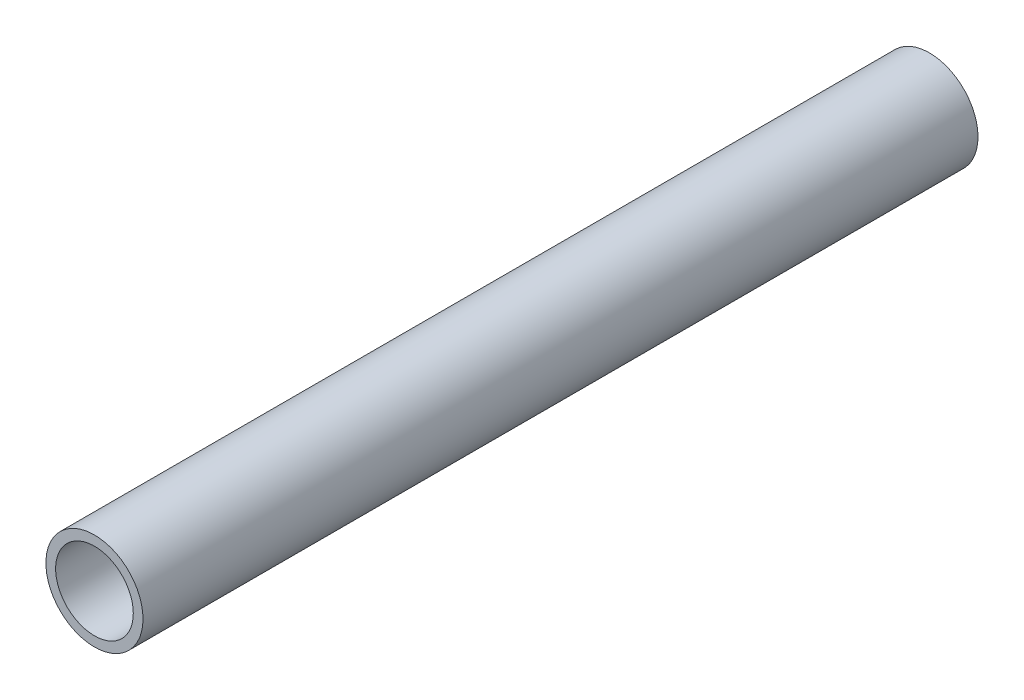
from build123d import *

# Parameters (mm, degrees)
SKETCH25_R           = 50
SKETCH25_R_2         = 40
BOSS_EXTRUDE16_DEPTH = 860


with BuildPart() as part:
    # Sketch25 → Boss-Extrude16 (new body)
    with BuildSketch(Plane.XY):
        with Locations((-894.504762148, 1142.583065453)):
            Circle(SKETCH25_R)
        with Locations((-894.504762148, 1142.583065453)):
            Circle(SKETCH25_R_2, mode=Mode.SUBTRACT)
    extrude(amount=BOSS_EXTRUDE16_DEPTH)


solid = part.part
